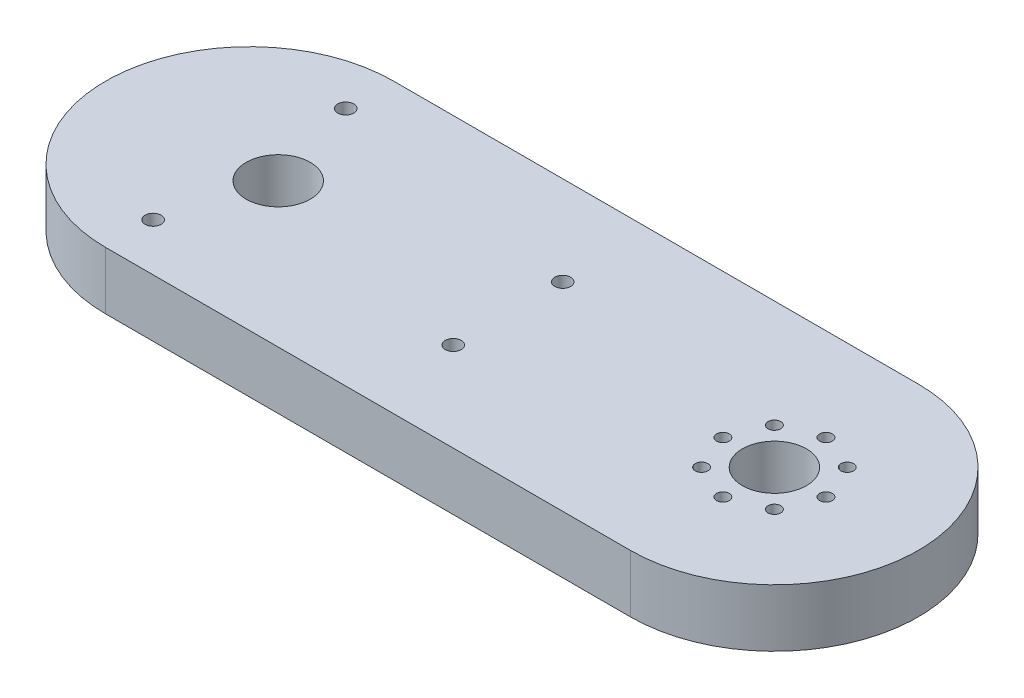
from build123d import *

# Parameters (mm, degrees)
BOSS_EXTRUDE1_DEPTH     = 4.5
CUT_EXTRUDE1_DEPTH      = 68.966903711
CUT_EXTRUDE1_DEPTH_BACK = 68.966903711
SKETCH3_R               = 0.99
SKETCH4_R               = 5
CUT_EXTRUDE2_DEPTH      = 68.966903711
CUT_EXTRUDE3_DEPTH      = 68.966903711
CUT_EXTRUDE3_DEPTH_BACK = 68.966903711
SKETCH5_R               = 1.25
SKETCH5_R_2             = 5


with BuildPart() as part:
    # Sketch2 → Boss-Extrude1 (new, symmetric)
    with BuildSketch(Plane(origin=(0, 0, 0), x_dir=(1, 0, 0), z_dir=(0, 1, 0))):
        with BuildLine():
            Line((41, -22.5), (-41, -22.5))
            ThreePointArc((-41, -22.5), (-63.5, 0), (-41, 22.5))
            Line((-41, 22.5), (41, 22.5))
            ThreePointArc((41, 22.5), (63.5, 0), (41, -22.5))
        make_face()
    extrude(amount=BOSS_EXTRUDE1_DEPTH, both=True)

    # Sketch3 → Cut-Extrude1 (cut, two sides: drawn at the far end of the back side and taken through both)
    with BuildSketch(Plane(origin=(0, 4.5, 0), x_dir=(1, 0, 0), z_dir=(0, 1, 0)).offset(-CUT_EXTRUDE1_DEPTH_BACK)):
        with Locations(Location((46.692209589, 5.692209589, 0), (0, 0, 270))):
            Circle(SKETCH3_R)
        with Locations(Location((41, 8.05, 0), (0, 0, 270))):
            Circle(SKETCH3_R)
        with Locations(Location((49.05, 0, 0), (0, 0, 270))):
            Circle(SKETCH3_R)
        with Locations(Location((46.692209589, -5.692209589, 0), (0, 0, 270))):
            Circle(SKETCH3_R)
        with Locations(Location((41, -8.05, 0), (0, 0, 270))):
            Circle(SKETCH3_R)
        with Locations(Location((35.307790411, -5.692209589, 0), (0, 0, 270))):
            Circle(SKETCH3_R)
        with Locations(Location((32.95, 0, 0), (0, 0, 270))):
            Circle(SKETCH3_R)
        with Locations(Location((35.307790411, 5.692209589, 0), (0, 0, 270))):
            Circle(SKETCH3_R)
    extrude(amount=CUT_EXTRUDE1_DEPTH + CUT_EXTRUDE1_DEPTH_BACK, mode=Mode.SUBTRACT)

    # Sketch4 → Cut-Extrude2 (cut, through all)
    with BuildSketch(Plane(origin=(0, 4.5, 0), x_dir=(1, 0, 0), z_dir=(0, 1, 0))):
        with Locations(Location((41, 0, 0), (0, 0, 270))):
            Circle(SKETCH4_R)
    extrude(amount=-CUT_EXTRUDE2_DEPTH, mode=Mode.SUBTRACT)

    # Sketch5 → Cut-Extrude3 (cut, two sides: drawn at the far end of the back side and taken through both)
    with BuildSketch(Plane(origin=(0, 4.5, 0), x_dir=(1, 0, 0), z_dir=(0, 1, 0)).offset(-CUT_EXTRUDE3_DEPTH_BACK)):
        with Locations(Location((-41.025026068, -15.05, 0), (0, 0, 270))):
            Circle(SKETCH5_R)
        with Locations(Location((-41.025026068, 15.05, 0), (0, 0, 270))):
            Circle(SKETCH5_R)
        with Locations(Location((-0.625026068, 8.55, 0), (0, 0, 270))):
            Circle(SKETCH5_R)
        with Locations(Location((-0.625026068, -8.55, 0), (0, 0, 270))):
            Circle(SKETCH5_R)
        with Locations(Location((-36.525026068, 0, 0), (0, 0, 270))):
            Circle(SKETCH5_R_2)
    extrude(amount=CUT_EXTRUDE3_DEPTH + CUT_EXTRUDE3_DEPTH_BACK, mode=Mode.SUBTRACT)


solid = part.part
